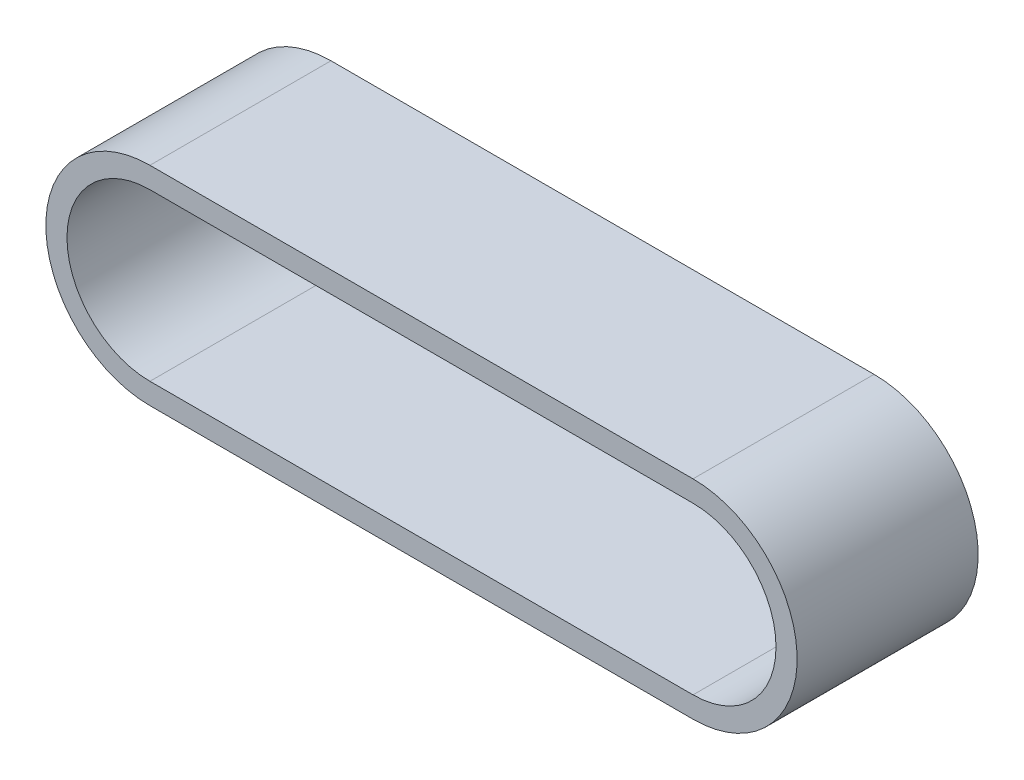
from build123d import *

# Parameters (mm, degrees)
SALIENTE_EXTRUIR1_DEPTH = 12


with BuildPart() as part:
    # Croquis1 → Saliente-Extruir1 (new body)
    with BuildSketch(Plane.XY):
        with BuildLine():
            Line((0, 6.9), (36, 6.9))
            ThreePointArc((36, 6.9), (42.9, 0), (36, -6.9))
            Line((36, -6.9), (0, -6.9))
            ThreePointArc((0, -6.9), (-6.9, 0), (0, 6.9))
        make_face()
        with BuildLine():
            Line((0, 5.5), (36, 5.5))
            ThreePointArc((36, 5.5), (41.5, 0), (36, -5.5))
            Line((36, -5.5), (0, -5.5))
            ThreePointArc((0, -5.5), (-5.5, 0), (0, 5.5))
        make_face(mode=Mode.SUBTRACT)
    extrude(amount=SALIENTE_EXTRUIR1_DEPTH)


solid = part.part
